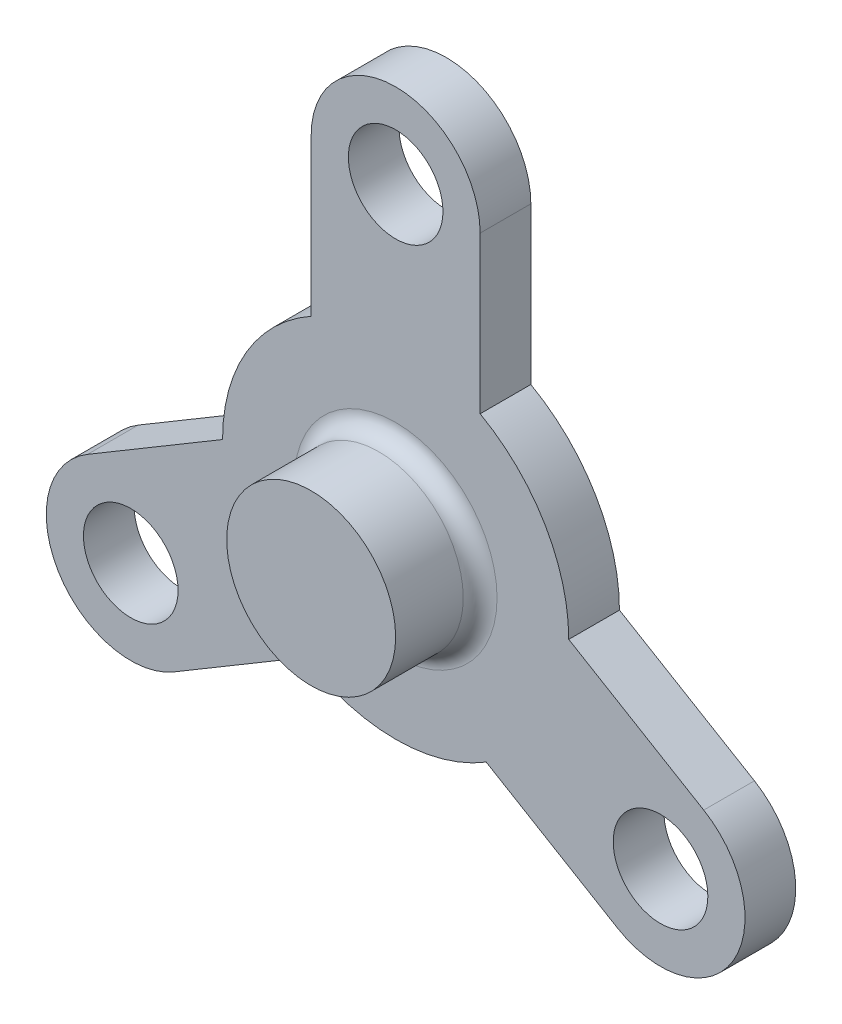
from build123d import *

# Parameters (mm, degrees)
SALIENTE_EXTRUIR1_DEPTH = 3
CROQUIS2_R              = 2.8
CORTAR_EXTRUIR3_DEPTH   = 5.5
CROQUIS3_R              = 5
SALIENTE_EXTRUIR2_DEPTH = 5
REDONDEO1_R             = 1


with BuildPart() as part:
    # Croquis1 → Saliente-Extruir1 (new body)
    with BuildSketch(Plane.XY):
        with BuildLine():
            Line((-13.118348224, -13.346885602), (-5.358962429, -8.729934305))
            ThreePointArc((-5.358962429, -8.729934305), (0, -10.243545836), (5.358962429, -8.729934305))
            Line((5.358962429, -8.729934305), (13.118348224, -13.346885602))
            ThreePointArc((13.118348224, -13.346885602), (19.97194541, -11.606711584), (18.231771393, -4.753114398))
            Line((18.231771393, -4.753114398), (10.243545836, 0))
            ThreePointArc((10.243545836, 0), (8.83594818, 5.182301714), (5, 8.94037087))
            Line((5, 8.94037087), (5, 18.2))
            ThreePointArc((5, 18.2), (0, 23.2), (-5, 18.2))
            Line((-5, 18.2), (-5, 8.94037087))
            ThreePointArc((-5, 8.94037087), (-8.83594818, 5.182301714), (-10.243545836, 0))
            Line((-10.243545836, 0), (-18.231771393, -4.753114398))
            ThreePointArc((-18.231771393, -4.753114398), (-19.97194541, -11.606711584), (-13.118348224, -13.346885602))
        make_face()
    extrude(amount=SALIENTE_EXTRUIR1_DEPTH)

    # Croquis2 → Cortar-Extruir3 (cut)
    with BuildSketch(Plane.XY.offset(3)):
        with Locations((0, 18.2)):
            Circle(CROQUIS2_R)
        with Locations((15.675059808, -9.05)):
            Circle(CROQUIS2_R)
        with Locations((-15.675059808, -9.05)):
            Circle(CROQUIS2_R)
    extrude(amount=-CORTAR_EXTRUIR3_DEPTH, mode=Mode.SUBTRACT)

    # Croquis3 → Saliente-Extruir2 (add)
    with BuildSketch(Plane.XY.offset(3)):
        Circle(CROQUIS3_R)
    extrude(amount=SALIENTE_EXTRUIR2_DEPTH)

    # Redondeo1
    redondeo1_edges = [part.edges().sort_by_distance(p)[0] for p in [
        (-5, 0, 3),
    ]]
    fillet(redondeo1_edges, radius=REDONDEO1_R)


solid = part.part
